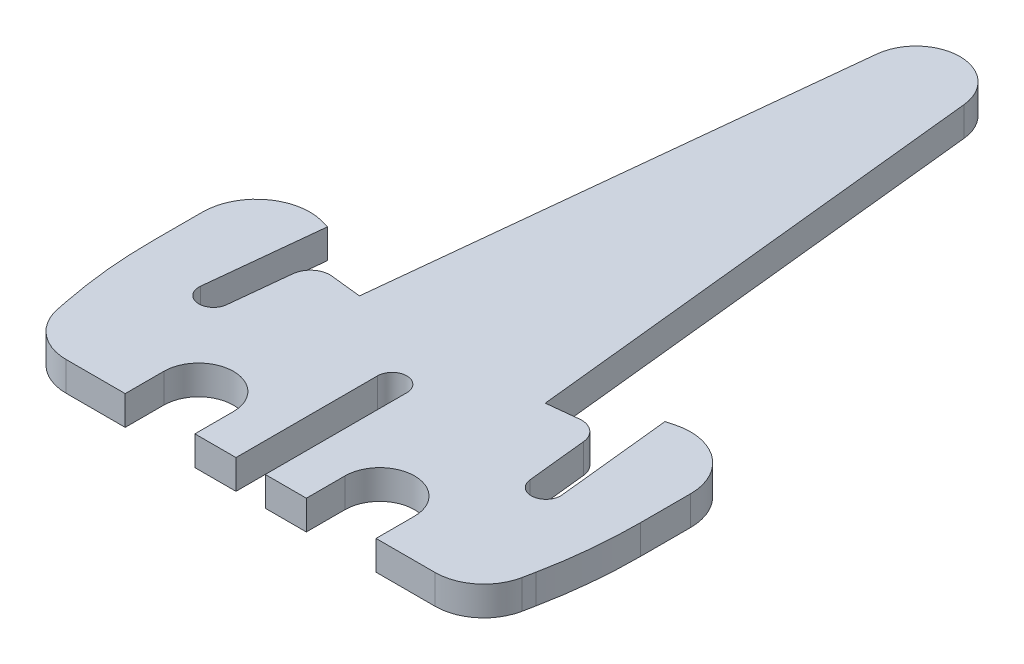
from build123d import *

# Parameters (mm, degrees)
BOSS_EXTRUDE1_DEPTH = 3


with BuildPart() as part:
    # Sketch1 → Boss-Extrude1 (new body)
    with BuildSketch(Plane(origin=(0, 0, 0), x_dir=(1, 0, 0), z_dir=(0, 1, 0))):
        with BuildLine():
            Line((4.475348529, 54.140378085), (9.517238433, 6.17))
            Line((9.517238433, 6.17), (12.686230549, 6.513661021))
            ThreePointArc((12.686230549, 6.513661021), (14.15792829, 6.081687043), (14.890899928, 4.734375521))
            Line((14.890899928, 4.734375521), (15.538277417, -1.425009852))
            ThreePointArc((15.538277417, -1.425009852), (17.186852955, -2.76), (18.521843103, -1.111424462))
            Line((18.521843103, -1.111424462), (17.283321421, 10.672322207))
            Line((17.283321421, 10.672322207), (18.076495252, 10.884852494))
            ThreePointArc((18.076495252, 10.884852494), (22.84818786, 9.935703821), (25, 5.572260449))
            Line((25, 5.572260449), (25, 0.469626618))
            ThreePointArc((25, 0.469626618), (24.758369054, -4.440028067), (24.035811635, -9.302229772))
            Line((24.035811635, -9.302229772), (23.801666433, -10.477185639))
            ThreePointArc((23.801666433, -10.477185639), (22.069368276, -13.36561303), (18.89808527, -14.5))
            Line((18.89808527, -14.5), (12.85, -14.5))
            Line((12.85, -14.5), (12.85, -10.55))
            ThreePointArc((12.85, -10.55), (9.28, -6.98), (5.71, -10.55))
            Line((5.71, -10.55), (5.71, -14.5))
            Line((5.71, -14.5), (1.5, -14.5))
            Line((1.5, -14.5), (1.5, 0))
            ThreePointArc((1.5, 0), (0, 1.5), (-1.5, 0))
            Line((-1.5, 0), (-1.5, -14.5))
            Line((-1.5, -14.5), (-5.71, -14.5))
            Line((-5.71, -14.5), (-5.71, -10.55))
            ThreePointArc((-5.71, -10.55), (-9.28, -6.98), (-12.85, -10.55))
            Line((-12.85, -10.55), (-12.85, -14.5))
            Line((-12.85, -14.5), (-18.89808527, -14.5))
            ThreePointArc((-18.89808527, -14.5), (-22.069368276, -13.36561303), (-23.801666433, -10.477185639))
            Line((-23.801666433, -10.477185639), (-24.035811635, -9.302229772))
            ThreePointArc((-24.035811635, -9.302229772), (-24.758369054, -4.440028067), (-25, 0.469626618))
            Line((-25, 0.469626618), (-25, 5.572260449))
            ThreePointArc((-25, 5.572260449), (-22.84818786, 9.935703821), (-18.076495252, 10.884852494))
            Line((-18.076495252, 10.884852494), (-17.283321421, 10.672322207))
            Line((-17.283321421, 10.672322207), (-18.521843103, -1.111424462))
            ThreePointArc((-18.521843103, -1.111424462), (-17.186852955, -2.76), (-15.538277417, -1.425009852))
            Line((-15.538277417, -1.425009852), (-14.890899928, 4.734375521))
            ThreePointArc((-14.890899928, 4.734375521), (-14.15792829, 6.081687043), (-12.686230549, 6.513661021))
            Line((-12.686230549, 6.513661021), (-9.517238433, 6.17))
            Line((-9.517238433, 6.17), (-4.475348529, 54.140378085))
            ThreePointArc((-4.475348529, 54.140378085), (0, 58.17), (4.475348529, 54.140378085))
        make_face()
    extrude(amount=BOSS_EXTRUDE1_DEPTH)


solid = part.part
